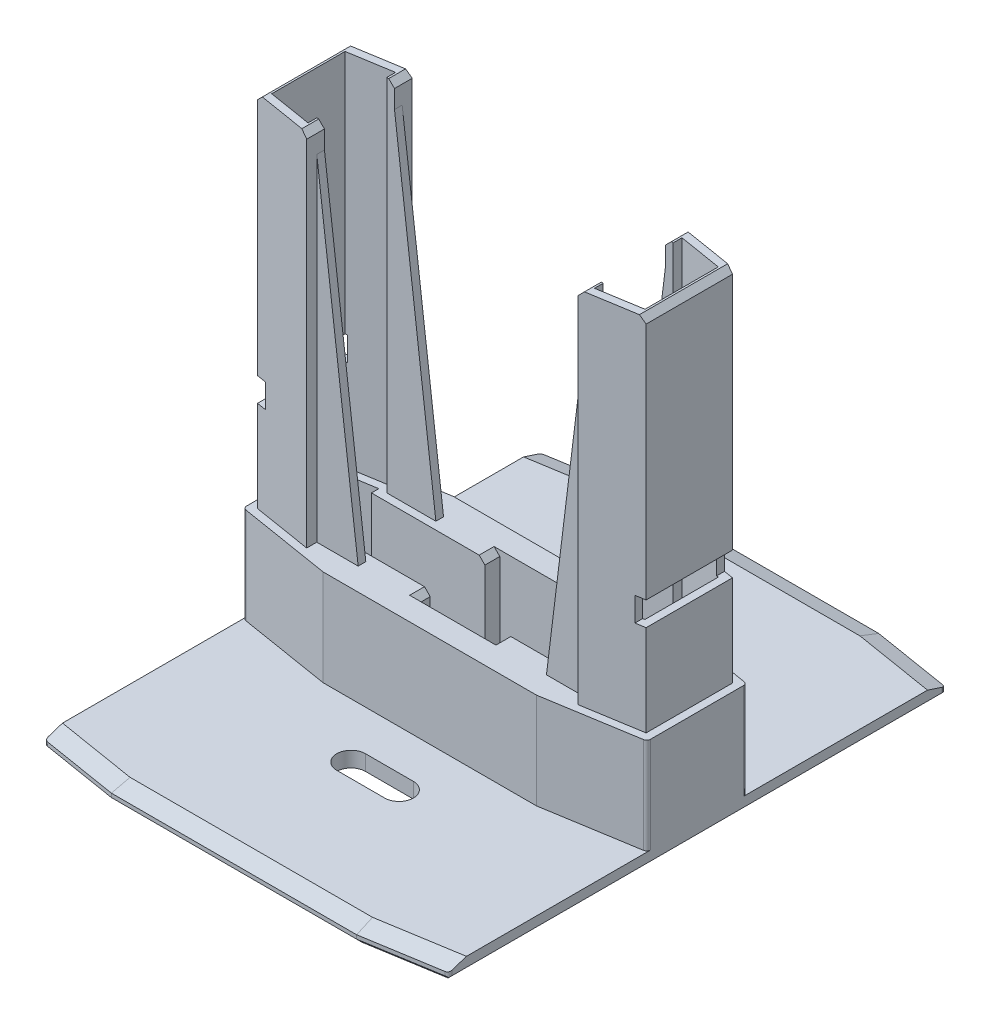
from build123d import *
from OCP.BRepFilletAPI import BRepFilletAPI_MakeChamfer

# Parameters (mm, degrees)
BOSS_EXTRUDE1_DEPTH     = 23.2
BOSS_EXTRUDE2_START     = 23.2
BOSS_EXTRUDE2_DEPTH     = 75
CUT_EXTRUDE1_DEPTH      = 108.706127959
CUT_EXTRUDE1_DEPTH_BACK = 108.706127959
SKETCH2_W               = 2
SKETCH2_H               = 5
CUT_EXTRUDE2_DEPTH      = 108.706127959
CUT_EXTRUDE2_DEPTH_BACK = 108.706127959
BOSS_EXTRUDE3_DEPTH     = 3.2
CUT_EXTRUDE3_DEPTH      = 111.057303256
CUT_EXTRUDE3_DEPTH_BACK = 111.057303256
BOSS_EXTRUDE4_DEPTH     = 3.2
BOSS_EXTRUDE5_DEPTH     = 3.2
CUT_EXTRUDE4_DEPTH      = 3.2
CHAMFER1_SIZE           = 1.2
CHAMFER1_SIZE2          = 3.6
CHAMFER2_SIZE           = 1.2
FILLET1_R               = 0.8


with BuildPart() as part:
    # Sketch1 → Boss-Extrude1 (new body)
    with BuildSketch(Plane(origin=(0, 0, 0), x_dir=(1, 0, 0), z_dir=(0, 1, 0))):
        Polygon((-22.25475327, 13.6), (22.25475327, 13.6), (42.1, 10.359959718), (42.1, -10.359959718), (22.25475327, -13.6), (-22.25475327, -13.6), (-42.1, -10.359959718), (-42.1, 10.359959718), align=None)
    extrude(amount=BOSS_EXTRUDE1_DEPTH)

    # Sketch1<3> → Boss-Extrude2 (add)
    with BuildSketch(Plane(origin=(0, 0, 0), x_dir=(1, 0, 0), z_dir=(0, 1, 0)).offset(BOSS_EXTRUDE2_START)):
        Polygon((40.5, -9), (28.25, -11), (28.25, -8.9), (11, -8.9), (11, -12), (-11, -12), (-11, -8.9), (-28.25, -8.9), (-28.25, -11), (-40.5, -9), (-40.5, 9), (-28.25, 11), (-28.25, 8.9), (-11, 8.9), (-11, 12), (11, 12), (11, 8.9), (28.25, 8.9), (28.25, 11), (40.5, 9), align=None)
        Polygon((-38.9, -7.640040282), (-29.85, -9.117591303), (-29.85, -7.3), (-9.4, -7.3), (-9.4, -10.4), (9.4, -10.4), (9.4, -7.3), (29.85, -7.3), (29.85, -9.117591303), (38.9, -7.640040282), (38.9, 7.640040282), (29.85, 9.117591303), (29.85, 7.3), (9.4, 7.3), (9.4, 10.4), (-9.4, 10.4), (-9.4, 7.3), (-29.85, 7.3), (-29.85, 9.117591303), (-38.9, 7.640040282), align=None, mode=Mode.SUBTRACT)
    extrude(amount=BOSS_EXTRUDE2_DEPTH)

    # Sketch2 → Cut-Extrude1 (cut, two sides: drawn at the far end of the back side and taken through both)
    with BuildSketch(Plane.XY.offset(-CUT_EXTRUDE1_DEPTH_BACK)):
        with Locations((-39.5, 44.7)):
            Rectangle(SKETCH2_W, SKETCH2_H)
        with Locations((39.5, 44.7)):
            Rectangle(SKETCH2_W, SKETCH2_H)
    extrude(amount=CUT_EXTRUDE1_DEPTH + CUT_EXTRUDE1_DEPTH_BACK, mode=Mode.SUBTRACT)

    # Sketch3 → Cut-Extrude2 (cut, two sides: drawn at the far end of the back side and taken through both)
    with BuildSketch(Plane.XY.offset(-CUT_EXTRUDE2_DEPTH_BACK)):
        Polygon((-28.25, 93.2), (-19.625, 23.2), (19.625, 23.2), (28.25, 93.2), (28.25, 98.2), (-28.25, 98.2), align=None)
    extrude(amount=CUT_EXTRUDE2_DEPTH + CUT_EXTRUDE2_DEPTH_BACK, mode=Mode.SUBTRACT)

    # Sketch4 → Boss-Extrude3 (add)
    with BuildSketch(Plane(origin=(0, 0, 0), x_dir=(1, 0, 0), z_dir=(0, 1, 0))):
        Polygon((23.292779429, 26.4), (42.1, 23.329433376), (42.1, -23.329433376), (23.292779429, -26.4), (-23.292779429, -26.4), (-42.1, -23.329433376), (-42.1, 23.329433376), (-23.292779429, 26.4), align=None)
    extrude(amount=BOSS_EXTRUDE3_DEPTH)

    # Sketch1<4> → Cut-Extrude3 (cut, two sides: drawn at the far end of the back side and taken through both)
    with BuildSketch(Plane(origin=(0, 0, 0), x_dir=(1, 0, 0), z_dir=(0, 1, 0)).offset(-CUT_EXTRUDE3_DEPTH_BACK)):
        Polygon((-31.45, -5.7), (-7.8, -5.7), (-7.8, -8.8), (7.8, -8.8), (7.8, -5.7), (31.45, -5.7), (31.45, -7.235182606), (37.3, -6.280080565), (37.3, 6.280080565), (31.45, 7.235182606), (31.45, 5.7), (7.8, 5.7), (7.8, 8.8), (-7.8, 8.8), (-7.8, 5.7), (-31.45, 5.7), (-31.45, 7.235182606), (-37.3, 6.280080565), (-37.3, -6.280080565), (-31.45, -7.235182606), align=None)
    extrude(amount=CUT_EXTRUDE3_DEPTH + CUT_EXTRUDE3_DEPTH_BACK, mode=Mode.SUBTRACT)

    # Sketch5 → Boss-Extrude4 (add)
    with BuildSketch(Plane(origin=(0, 0, 0), x_dir=(1, 0, 0), z_dir=(0, 1, 0))):
        Polygon((23.292779429, 26.4), (42.1, 23.329433376), (42.1, 51.700157004), (25.563461651, 54.4), (-25.563461651, 54.4), (-42.1, 51.700157004), (-42.1, 23.329433376), (-23.292779429, 26.4), align=None)
        Polygon((-42.1, -23.329433376), (-42.1, -51.700157004), (-25.563461651, -54.4), (25.563461651, -54.4), (42.1, -51.700157004), (42.1, -23.329433376), (23.292779429, -26.4), (-23.292779429, -26.4), align=None)
    extrude(amount=BOSS_EXTRUDE4_DEPTH)

    # Sketch6 → Boss-Extrude5 (add)
    with BuildSketch(Plane(origin=(0, 0, 0), x_dir=(1, 0, 0), z_dir=(0, 1, 0))):
        Polygon((25.563461651, 54.4), (42.1, 51.700157004), (42.1, 48.100157004), (-42.1, 48.100157004), (-42.1, 51.700157004), (-25.563461651, 54.4), align=None)
        Polygon((42.1, -48.100157004), (42.1, -51.700157004), (25.563461651, -54.4), (-25.563461651, -54.4), (-42.1, -51.700157004), (-42.1, -48.100157004), align=None)
    extrude(amount=BOSS_EXTRUDE5_DEPTH)

    # Sketch7 → Cut-Extrude4 (cut)
    with BuildSketch(Plane(origin=(0, 0, 0), x_dir=(0, 0, -1), z_dir=(0, 1, 0))):
        with BuildLine():
            Line((28, -5), (28, 5))
            ThreePointArc((28, 5), (25, 8), (22, 5))
            Line((22, 5), (22, -5))
            ThreePointArc((22, -5), (25, -8), (28, -5))
        make_face()
        with BuildLine():
            Line((-28, -5), (-28, 5))
            ThreePointArc((-28, 5), (-25, 8), (-22, 5))
            Line((-22, 5), (-22, -5))
            ThreePointArc((-22, -5), (-25, -8), (-28, -5))
        make_face()
    extrude(amount=CUT_EXTRUDE4_DEPTH, mode=Mode.SUBTRACT)

    # Chamfer1: one chamfer whose edges measure the first distance from different faces: ONE call of the kernel's chamfer builder (chamfer() names one face for all edges)
    chamfer1_edges_1 = [part.edges().sort_by_distance(p)[0] for p in [
        (-33.831730825, 3.2, 53.050078502),
    ]]
    chamfer1_side_1 = [part.faces().sort_by_distance(p)[0] for p in [
        (-33.831730825, 1.6, 53.050078502),
    ]]
    chamfer1_edges_2 = [part.edges().sort_by_distance(p)[0] for p in [
        (0, 3.2, 54.4),
    ]]
    chamfer1_side_2 = [part.faces().sort_by_distance(p)[0] for p in [
        (0, 1.6, 54.4),
    ]]
    chamfer1_edges_3 = [part.edges().sort_by_distance(p)[0] for p in [
        (33.831730825, 3.2, 53.050078502),
    ]]
    chamfer1_side_3 = [part.faces().sort_by_distance(p)[0] for p in [
        (33.831730825, 1.6, 53.050078502),
    ]]
    chamfer1_edges_4 = [part.edges().sort_by_distance(p)[0] for p in [
        (33.831730825, 3.2, -53.050078502),
    ]]
    chamfer1_side_4 = [part.faces().sort_by_distance(p)[0] for p in [
        (33.831730825, 1.6, -53.050078502),
    ]]
    chamfer1_edges_5 = [part.edges().sort_by_distance(p)[0] for p in [
        (0, 3.2, -54.4),
    ]]
    chamfer1_side_5 = [part.faces().sort_by_distance(p)[0] for p in [
        (0, 1.6, -54.4),
    ]]
    chamfer1_edges_6 = [part.edges().sort_by_distance(p)[0] for p in [
        (-33.831730825, 3.2, -53.050078502),
    ]]
    chamfer1_side_6 = [part.faces().sort_by_distance(p)[0] for p in [
        (-33.831730825, 1.6, -53.050078502),
    ]]
    chamfer1 = BRepFilletAPI_MakeChamfer(part.part.solid().wrapped)
    for e in chamfer1_edges_1:
        chamfer1.Add(CHAMFER1_SIZE, CHAMFER1_SIZE2, e.wrapped, chamfer1_side_1[0].wrapped)  # the first distance lies on this face
    for e in chamfer1_edges_2:
        chamfer1.Add(CHAMFER1_SIZE, CHAMFER1_SIZE2, e.wrapped, chamfer1_side_2[0].wrapped)  # the first distance lies on this face
    for e in chamfer1_edges_3:
        chamfer1.Add(CHAMFER1_SIZE, CHAMFER1_SIZE2, e.wrapped, chamfer1_side_3[0].wrapped)  # the first distance lies on this face
    for e in chamfer1_edges_4:
        chamfer1.Add(CHAMFER1_SIZE, CHAMFER1_SIZE2, e.wrapped, chamfer1_side_4[0].wrapped)  # the first distance lies on this face
    for e in chamfer1_edges_5:
        chamfer1.Add(CHAMFER1_SIZE, CHAMFER1_SIZE2, e.wrapped, chamfer1_side_5[0].wrapped)  # the first distance lies on this face
    for e in chamfer1_edges_6:
        chamfer1.Add(CHAMFER1_SIZE, CHAMFER1_SIZE2, e.wrapped, chamfer1_side_6[0].wrapped)  # the first distance lies on this face
    add(Compound.cast(chamfer1.Shape()), mode=Mode.REPLACE)

    # Chamfer2
    chamfer2_edges = [part.edges().sort_by_distance(p)[0] for p in [
        (-42.1, 0, 0),
        (-7.8, 23.2, 7.25),
        (7.8, 23.2, 7.25),
        (7.8, 23.2, -7.25),
        (-7.8, 23.2, -7.25),
        (-7.8, 0, -7.25),
        (7.8, 0, -7.25),
        (7.8, 0, 7.25),
        (-7.8, 0, 7.25),
        (40.5, 98.2, 0),
        (28.25, 98.2, -9.15),
        (-28.25, 98.2, 9.15),
        (0, 0, 54.4),
        (33.831730825, 0, 53.050078502),
        (-33.831730825, 0, 53.050078502),
        (33.831730825, 0, -53.050078502),
        (0, 0, -54.4),
        (-33.831730825, 0, -53.050078502),
        (28.25, 98.2, 9.15),
        (-28.25, 98.2, -9.15),
        (-40.5, 98.2, 0),
        (42.1, 0, 0),
    ]]
    chamfer(chamfer2_edges, length=CHAMFER2_SIZE)

    # Fillet1
    fillet1_edges = [part.edges().sort_by_distance(p)[0] for p in [
        (-42.1, 13.2, 10.359959718),
        (42.1, 13.2, 10.359959718),
        (42.1, 13.2, -10.359959718),
        (-42.1, 13.2, -10.359959718),
        (-42.1, 1.6, 51.700157004),
        (-42.1, 1.6, -51.700157004),
        (42.1, 1.6, -51.700157004),
        (42.1, 1.6, 51.700157004),
    ]]
    fillet(fillet1_edges, radius=FILLET1_R)


solid = part.part
